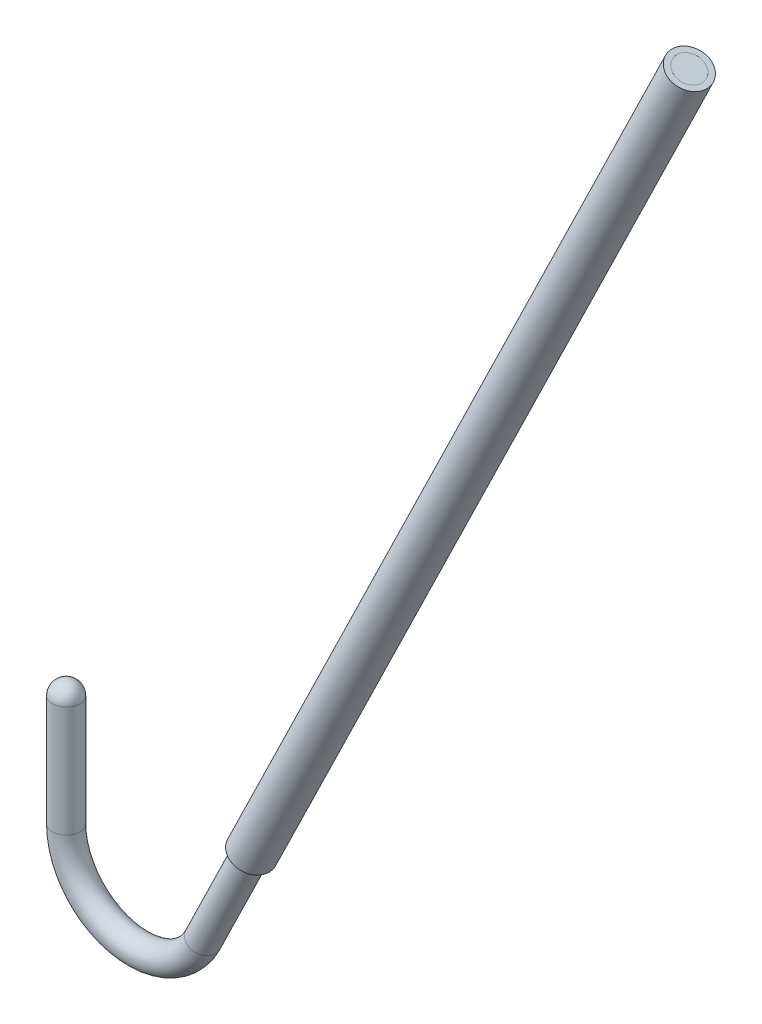
from build123d import *

# Parameters (mm, degrees)
SKETCH1_R           = 0.25
SKETCH4_R           = 0.35
SKETCH4_R_2         = 0.25
BOSS_EXTRUDE1_DEPTH = 18


with BuildPart() as part:
    # Sweep1: sweep along a path in Sketch2
    with BuildLine(Plane.XY) as sweep1_path:
        Line((0, 0), (0, -2))
        ThreePointArc((0, -2), (1.007563629, -3.266681084), (2.46843226, -2.569882491))
        Line((2.46843226, -2.569882491), (11.235855196, 15.405998435))
    # Sketch1 → Sweep1 (sweep)
    with BuildSketch(Plane(origin=(0, 0, 0), x_dir=(1, 0, 0), z_dir=(0, 1, 0))):
        Circle(SKETCH1_R)
    sweep(path=sweep1_path.line)

    # Sketch3 → Revolve1 (revolve)
    with BuildSketch(Plane(origin=(0, 0, 0), x_dir=(0, 0, -1), z_dir=(1, 0, 0))):
        with BuildLine():
            Line((0, -0.25), (0, 0.25))
            ThreePointArc((0, 0.25), (-0.25, 0), (0, -0.25))
        make_face()
    revolve(axis=Axis((0, -0.25, 0), (0, 1, 0)))


with BuildPart() as body_2:
    # Sketch4 → Boss-Extrude1 (new body)
    with BuildSketch(Plane(origin=(8.229232223, 16.872426441, 0), x_dir=(0.8987940462991698, -0.43837114678907185, 0), z_dir=(0.4383711467890718, 0.8987940462991697, 0))):
        with Locations((3.345174554, 0)):
            Circle(SKETCH4_R)
        with Locations((3.345174554, 0)):
            Circle(SKETCH4_R_2, mode=Mode.SUBTRACT)
    extrude(amount=-BOSS_EXTRUDE1_DEPTH)


solid = Compound([part.part, body_2.part])
